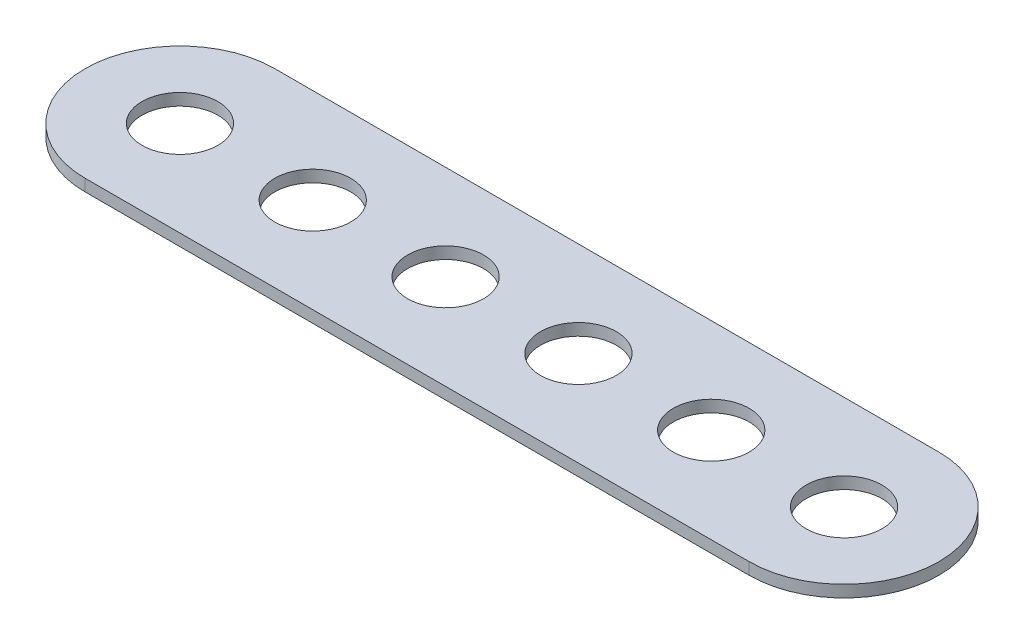
from build123d import *

# Parameters (mm, degrees)
BOSS_EXTRUDE1_DEPTH = 3.175
SKETCH3_R           = 10.16
CUT_EXTRUDE1_DEPTH  = 205.80595847
LPATTERN1_COUNT     = 6
LPATTERN1_PITCH     = 35.56


with BuildPart() as part:
    # Sketch1 → Boss-Extrude1 (new body)
    with BuildSketch(Plane(origin=(0, 0, 0), x_dir=(1, 0, 0), z_dir=(0, 1, 0))):
        with BuildLine():
            Line((0, 25.4), (-177.8, 25.4))
            ThreePointArc((-177.8, 25.4), (-203.2, 0), (-177.8, -25.4))
            Line((-177.8, -25.4), (0, -25.4))
            ThreePointArc((0, -25.4), (25.4, 0), (0, 25.4))
        make_face()
    extrude(amount=BOSS_EXTRUDE1_DEPTH)

    # Sketch3 → Cut-Extrude1 (cut, through all)
    with BuildSketch(Plane(origin=(0, 3.175, 0), x_dir=(1, 0, 0), z_dir=(0, 1, 0))):
        with Locations(Location((-177.8, 0, 0), (0, 0, 270))):
            Circle(SKETCH3_R)
    cut_extrude1 = extrude(amount=-CUT_EXTRUDE1_DEPTH, mode=Mode.SUBTRACT)

    # LPattern1: Cut-Extrude1 ×6
    with Locations(*[(i * LPATTERN1_PITCH, 0, 0) for i in range(1, LPATTERN1_COUNT)]):
        add(cut_extrude1, mode=Mode.SUBTRACT)


solid = part.part
